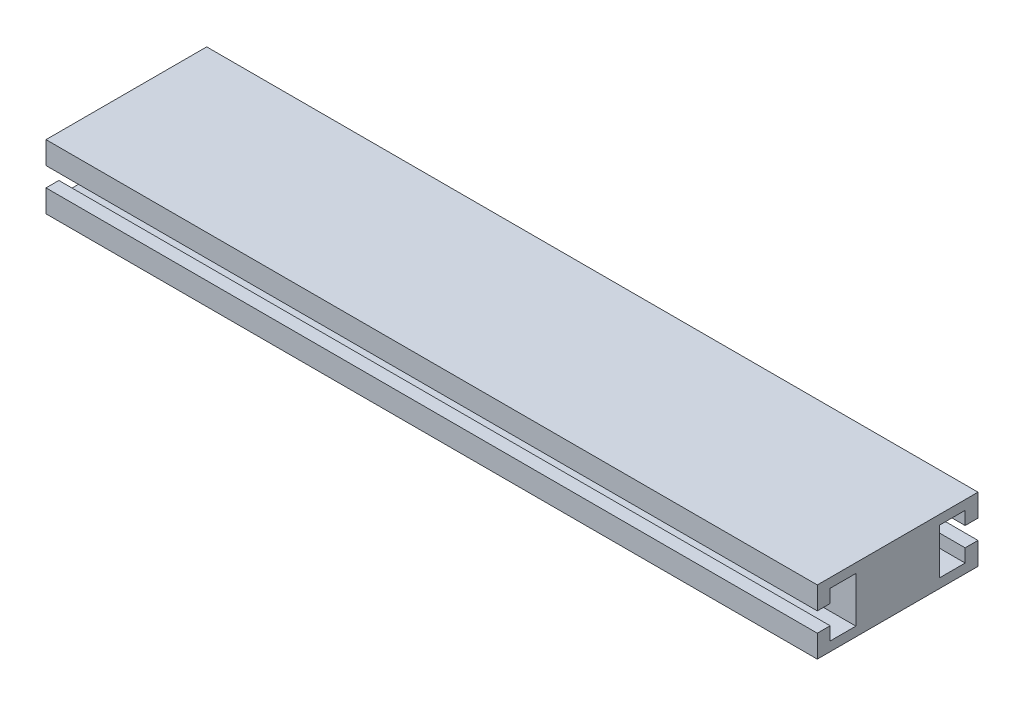
from build123d import *

# Parameters (mm, degrees)
SKETCH1_W           = 120
SKETCH1_H           = 25
BOSS_EXTRUDE1_DEPTH = 10
CUT_EXTRUDE1_DEPTH  = 120
CUT_EXTRUDE2_DEPTH  = 120


with BuildPart() as part:
    # Sketch1 → Boss-Extrude1 (new body)
    with BuildSketch(Plane(origin=(0, 0, 0), x_dir=(1, 0, 0), z_dir=(0, 1, 0))):
        with Locations((-95.061127507, -76.27261395)):
            Rectangle(SKETCH1_W, SKETCH1_H)
    extrude(amount=BOSS_EXTRUDE1_DEPTH)

    # Sketch2 → Cut-Extrude1 (cut)
    with BuildSketch(Plane(origin=(-35.061127507, 0, 0), x_dir=(0, 0, -1), z_dir=(1, 0, 0))):
        Polygon((-63.77261395, 6.5), (-65.77261395, 6.5), (-65.77261395, 8.55), (-69.77261395, 8.55), (-69.77261395, 1.45), (-65.77261395, 1.45), (-65.77261395, 3.5), (-63.77261395, 3.5), align=None)
    extrude(amount=-CUT_EXTRUDE1_DEPTH, mode=Mode.SUBTRACT)

    # Sketch3 → Cut-Extrude2 (cut)
    with BuildSketch(Plane(origin=(-35.061127507, 0, 0), x_dir=(0, 0, -1), z_dir=(1, 0, 0))):
        Polygon((-88.77261395, 6.5), (-86.77261395, 6.5), (-86.77261395, 8.55), (-82.77261395, 8.55), (-82.77261395, 1.45), (-86.77261395, 1.45), (-86.77261395, 3.5), (-88.77261395, 3.5), align=None)
    extrude(amount=-CUT_EXTRUDE2_DEPTH, mode=Mode.SUBTRACT)


solid = part.part
